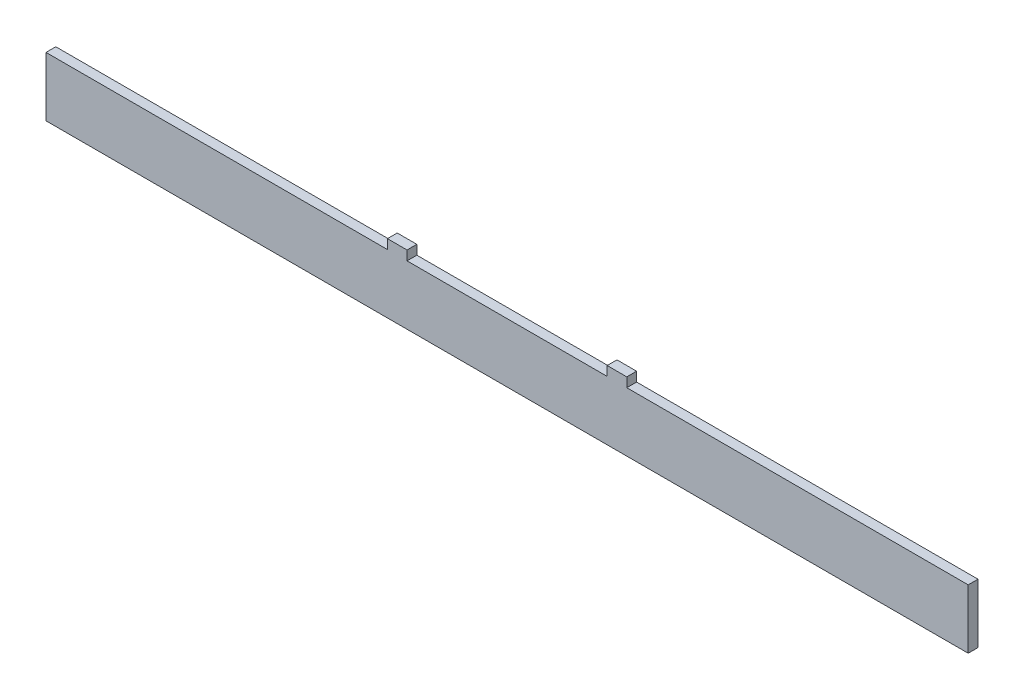
from build123d import *

# Parameters (mm, degrees)
SKETCH1_W           = 298.45
SKETCH1_H           = 3.175
BOSS_EXTRUDE1_DEPTH = 22.225
SKETCH2_W           = 110.49
SKETCH2_H           = 3.048
SKETCH2_W_2         = 64.77
CUT_EXTRUDE1_DEPTH  = 151.904379907


with BuildPart() as part:
    # Sketch1 → Boss-Extrude1 (new body)
    with BuildSketch(Plane(origin=(0, 0, 0), x_dir=(1, 0, 0), z_dir=(0, 1, 0))):
        Rectangle(SKETCH1_W, SKETCH1_H)
    extrude(amount=BOSS_EXTRUDE1_DEPTH)

    # Sketch2 → Cut-Extrude1 (cut, through all)
    with BuildSketch(Plane.XY.offset(1.5875)):
        with Locations((-93.98, 20.701)):
            Rectangle(SKETCH2_W, SKETCH2_H)
        with Locations((93.98, 20.701)):
            Rectangle(SKETCH2_W, SKETCH2_H)
        with Locations((0, 20.701)):
            Rectangle(SKETCH2_W_2, SKETCH2_H)
    extrude(amount=-CUT_EXTRUDE1_DEPTH, mode=Mode.SUBTRACT)


solid = part.part
